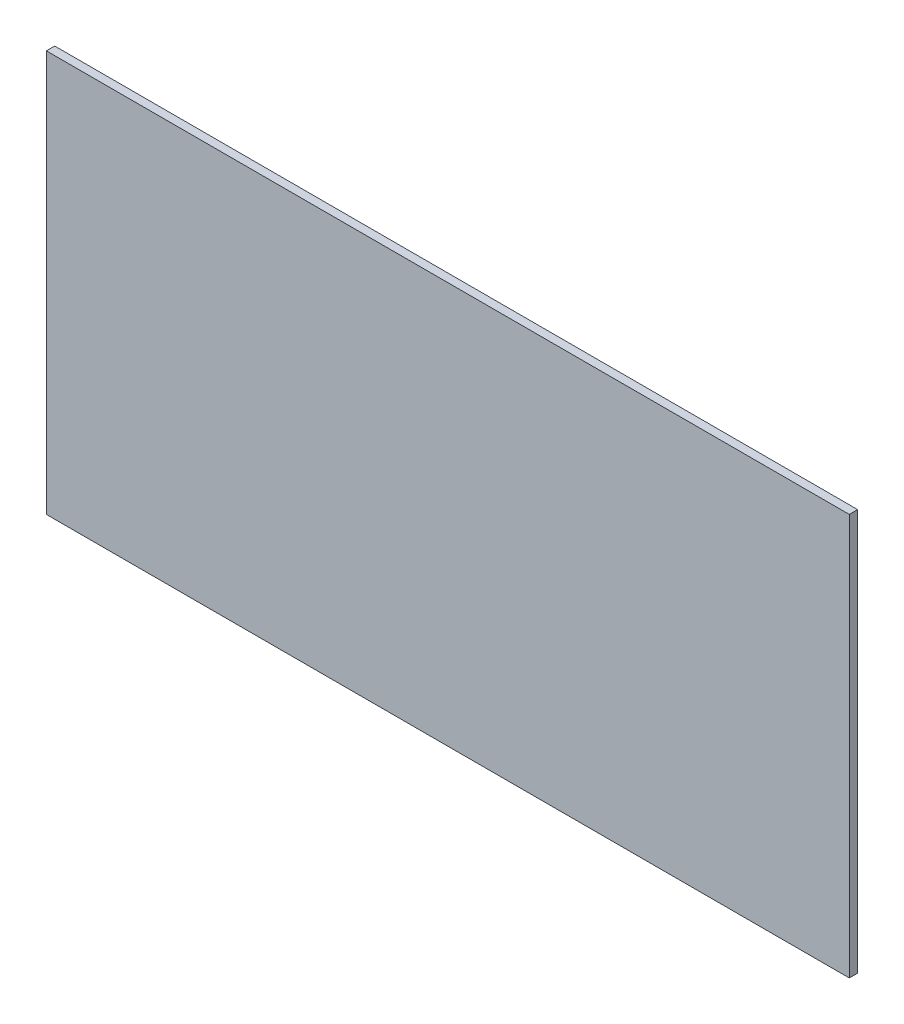
from build123d import *

# Parameters (mm, degrees)
SKETCH1_W           = 609.6
SKETCH1_H           = 304.8
BOSS_EXTRUDE1_DEPTH = 6.35


with BuildPart() as part:
    # Sketch1 → Boss-Extrude1 (new body)
    with BuildSketch(Plane.XY):
        with Locations((17.398090692, 24.036038186)):
            Rectangle(SKETCH1_W, SKETCH1_H)
    extrude(amount=BOSS_EXTRUDE1_DEPTH)


solid = part.part
